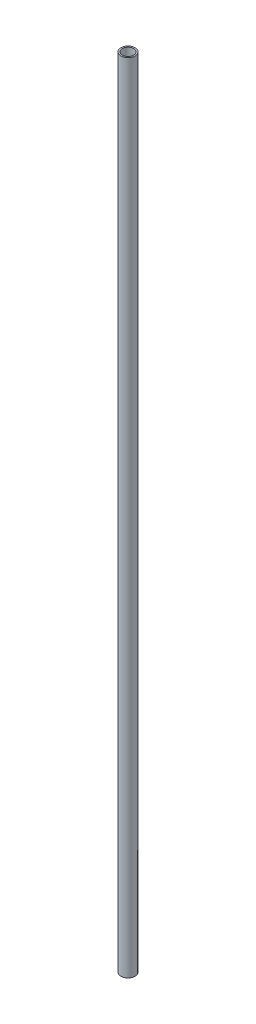
from build123d import *

# Parameters (mm, degrees)
SKETCH1_R           = 3.175
SKETCH1_R_2         = 2.54
BOSS_EXTRUDE1_DEPTH = 355.6


with BuildPart() as part:
    # Sketch1 → Boss-Extrude1 (new body)
    with BuildSketch(Plane(origin=(0, 0, 0), x_dir=(1, 0, 0), z_dir=(0, 1, 0))):
        with Locations(Location((0, 0, 0), (0, 0, 270))):
            Circle(SKETCH1_R)
        with Locations(Location((0, 0, 0), (0, 0, 270))):
            Circle(SKETCH1_R_2, mode=Mode.SUBTRACT)
    extrude(amount=BOSS_EXTRUDE1_DEPTH)


solid = part.part
